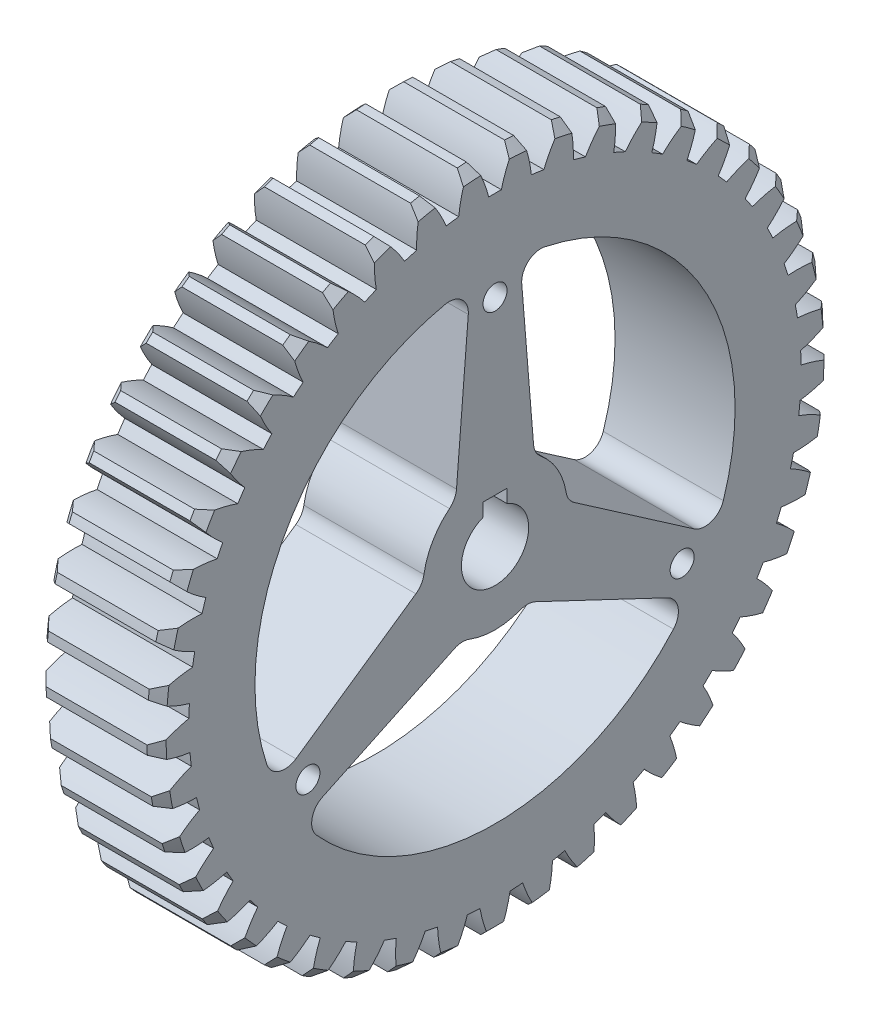
from build123d import *

# Parameters (mm, degrees)
BASPROSKE_W         = 25
BASPROSKE_H         = 70.5
CHAMFER_1_SIZE      = 2
TOOTHCUT_DEPTH      = 103.788618047
TEETHCUTS_COUNT     = 45
TEETHCUTS_ANGLE     = 352
BORSKE_R            = 7
BORE_DEPTH          = 50.0000508
KEYSKE_W            = 5
KEYSKE_H            = 9.3
KEYWAY_DEPTH        = 50.0000508
CUT_EXTRUDE_1_DEPTH = 103.777548373
SKETCH_2_R          = 2.5
CUT_EXTRUDE_2_DEPTH = 103.777548373
SKETCH_3_R          = 2
CUT_EXTRUDE_3_DEPTH = 10
FILLET_1_R          = 4


with BuildPart() as part:
    # BasProSke → Base-Revolve (revolve)
    with BuildSketch(Plane(origin=(0, 0, 0), x_dir=(1, 0, 0), z_dir=(0, 1, 0)), mode=Mode.PRIVATE) as base_revolve_sk:
        with Locations((12.5, 35.25)):
            Rectangle(BASPROSKE_W, BASPROSKE_H)
    revolve(base_revolve_sk.sketch.rotate(Axis((-10, 0, 0), (1, 0, 0)), 180), axis=Axis((-10, 0, 0), (1, 0, 0)))

    # 倒角1
    chamfer_1_edges = [part.edges().sort_by_distance(p)[0] for p in [
        (0, 0, -70.5),
        (25, 0, -70.5),
    ]]
    chamfer(chamfer_1_edges, length=CHAMFER_1_SIZE)

    # TooCutSke → ToothCut (cut, through all)
    with BuildSketch(Plane(origin=(0, 0, 0), x_dir=(0, 0, -1), z_dir=(1, 0, 0))):
        with BuildLine():
            ThreePointArc((1.316708302, 63.735400526), (0, 63.749), (-1.316708302, 63.735400526))
            ThreePointArc((-1.316708302, 63.735400526), (-2.42575679, 67.163254741), (-3.981315359, 70.412933281))
            ThreePointArc((-3.981315359, 70.412933281), (0, 70.5254), (3.981315359, 70.412933281))
            ThreePointArc((3.981315359, 70.412933281), (2.42575679, 67.163254741), (1.316708302, 63.735400526))
        make_face()
    toothcut = extrude(amount=TOOTHCUT_DEPTH, mode=Mode.SUBTRACT)

    # TeethCuts: ToothCut ×45 about axis
    teethcuts_axis = Axis((-10, 0, 0), (1, 0, 0))
    for i in range(1, TEETHCUTS_COUNT):
        add(toothcut.rotate(teethcuts_axis, i * TEETHCUTS_ANGLE / (TEETHCUTS_COUNT - 1)), mode=Mode.SUBTRACT)

    # BorSke → Bore (cut, symmetric)
    with BuildSketch(Plane(origin=(0, 0, 0), x_dir=(0, 0, -1), z_dir=(1, 0, 0))):
        with Locations(Location((0, 0, 0), (0, 0, 180))):
            Circle(BORSKE_R)
    extrude(amount=BORE_DEPTH, both=True, mode=Mode.SUBTRACT)

    # KeySke → Keyway (cut, symmetric)
    with BuildSketch(Plane(origin=(0, 0, 0), x_dir=(0, 0, -1), z_dir=(1, 0, 0))):
        with Locations((0, 4.65)):
            Rectangle(KEYSKE_W, KEYSKE_H)
    extrude(amount=KEYWAY_DEPTH, both=True, mode=Mode.SUBTRACT)

    # 草图1 → 切除-拉伸1 (cut, through all)
    with BuildSketch(Plane(origin=(0, 0, 0), x_dir=(0, 0, -1), z_dir=(1, 0, 0))):
        with BuildLine():
            Line((-5.157087895, 49.733333333), (-8.172484063, 12.578175712))
            ThreePointArc((-8.172484063, 12.578175712), (-12.990381057, 7.5), (-14.979261731, 0.788490955))
            Line((-14.979261731, 0.788490955), (-45.648874029, -20.40049754))
            ThreePointArc((-45.648874029, -20.40049754), (-43.301270189, 25), (-5.157087895, 49.733333333))
        make_face()
        with BuildLine():
            Line((45.648874029, -20.40049754), (14.979261731, 0.788490955))
            ThreePointArc((14.979261731, 0.788490955), (12.990381057, 7.5), (8.172484063, 12.578175712))
            Line((8.172484063, 12.578175712), (5.157087895, 49.733333333))
            ThreePointArc((5.157087895, 49.733333333), (43.301270189, 25), (45.648874029, -20.40049754))
        make_face()
        with BuildLine():
            Line((-40.491786134, -29.332835793), (-6.806777668, -13.366666667))
            ThreePointArc((-6.806777668, -13.366666667), (0, -15), (6.806777668, -13.366666667))
            Line((6.806777668, -13.366666667), (40.491786134, -29.332835793))
            ThreePointArc((40.491786134, -29.332835793), (0, -50), (-40.491786134, -29.332835793))
        make_face()
    extrude(amount=CUT_EXTRUDE_1_DEPTH, mode=Mode.SUBTRACT)

    # 草图2 → 切除-拉伸2 (cut, through all)
    with BuildSketch(Plane(origin=(0, 0, 0), x_dir=(0, 0, -1), z_dir=(1, 0, 0))):
        with Locations((0, 45)):
            Circle(SKETCH_2_R)
        with Locations((38.97114317, -22.5)):
            Circle(SKETCH_2_R)
        with Locations((-38.97114317, -22.5)):
            Circle(SKETCH_2_R)
    extrude(amount=CUT_EXTRUDE_2_DEPTH, mode=Mode.SUBTRACT)

    # 草图3 → 切除-拉伸3 (cut)
    with BuildSketch(Plane(origin=(0, 0, 0), x_dir=(0, 0, -1), z_dir=(1, 0, 0))):
        with Locations((0, 30)):
            Circle(SKETCH_3_R)
        with Locations((25.980762114, -15)):
            Circle(SKETCH_3_R)
        with Locations((-25.980762114, -15)):
            Circle(SKETCH_3_R)
    extrude(amount=CUT_EXTRUDE_3_DEPTH, mode=Mode.SUBTRACT)

    # 圆角1
    fillet_1_edges = [part.edges().sort_by_distance(p)[0] for p in [
        (12.5, -20.40049754, -45.648874029),
        (12.5, 49.733333333, -5.157087895),
        (12.5, 12.578175712, -8.172484063),
        (12.5, 0.788490955, -14.979261731),
        (12.5, -29.332835793, 40.491786134),
        (12.5, -29.332835793, -40.491786134),
        (12.5, -13.366666667, -6.806777668),
        (12.5, -13.366666667, 6.806777668),
        (12.5, 49.733333333, 5.157087895),
        (12.5, -20.40049754, 45.648874029),
        (12.5, 0.788490955, 14.979261731),
        (12.5, 12.578175712, 8.172484063),
    ]]
    fillet(fillet_1_edges, radius=FILLET_1_R)


solid = part.part
